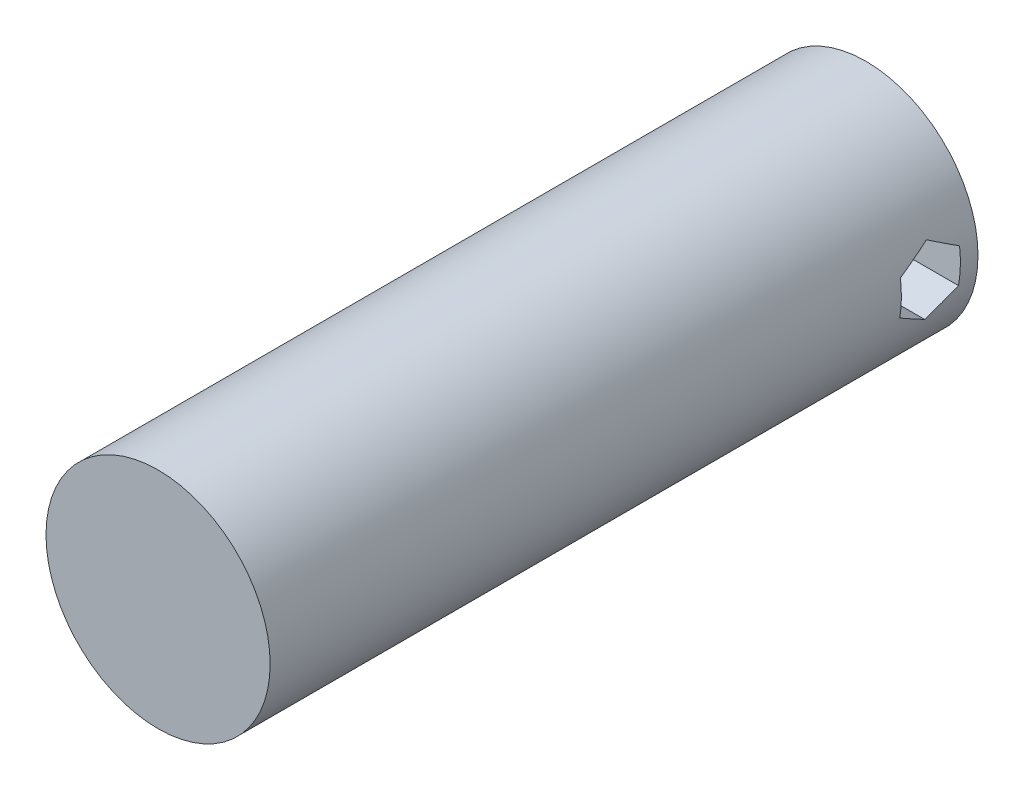
from build123d import *

# Parameters (mm, degrees)
SKETCH1_R           = 4.75
BOSS_EXTRUDE1_DEPTH = 30
CUT_EXTRUDE1_DEPTH  = 10
CUT_EXTRUDE2_DEPTH  = 31.902080836


with BuildPart() as part:
    # Sketch1 → Boss-Extrude1 (new body)
    with BuildSketch(Plane.XY):
        Circle(SKETCH1_R)
    extrude(amount=BOSS_EXTRUDE1_DEPTH)

    # Sketch2 → Cut-Extrude1 (cut)
    with BuildSketch(Plane(origin=(0, 0, 0), x_dir=(-1, 0, 0), z_dir=(0, 0, -1))):
        with BuildLine():
            Line((-0.94, 1.535057002), (-0.94, -1.535057002))
            ThreePointArc((-0.94, -1.535057002), (1.8, 0), (-0.94, 1.535057002))
        make_face()
    extrude(amount=-CUT_EXTRUDE1_DEPTH, mode=Mode.SUBTRACT)

    # Sketch3 → Cut-Extrude2 (cut, through all)
    with BuildSketch(Plane.ZY.offset(-0.94)):
        Polygon((3.230708553, 0.754115238), (1.962271323, 1.44288249), (0.73156277, 0.688767252), (0.769291447, -0.754115238), (2.037728677, -1.44288249), (3.26843723, -0.688767252), align=None)
    extrude(amount=-CUT_EXTRUDE2_DEPTH, mode=Mode.SUBTRACT)


solid = part.part
